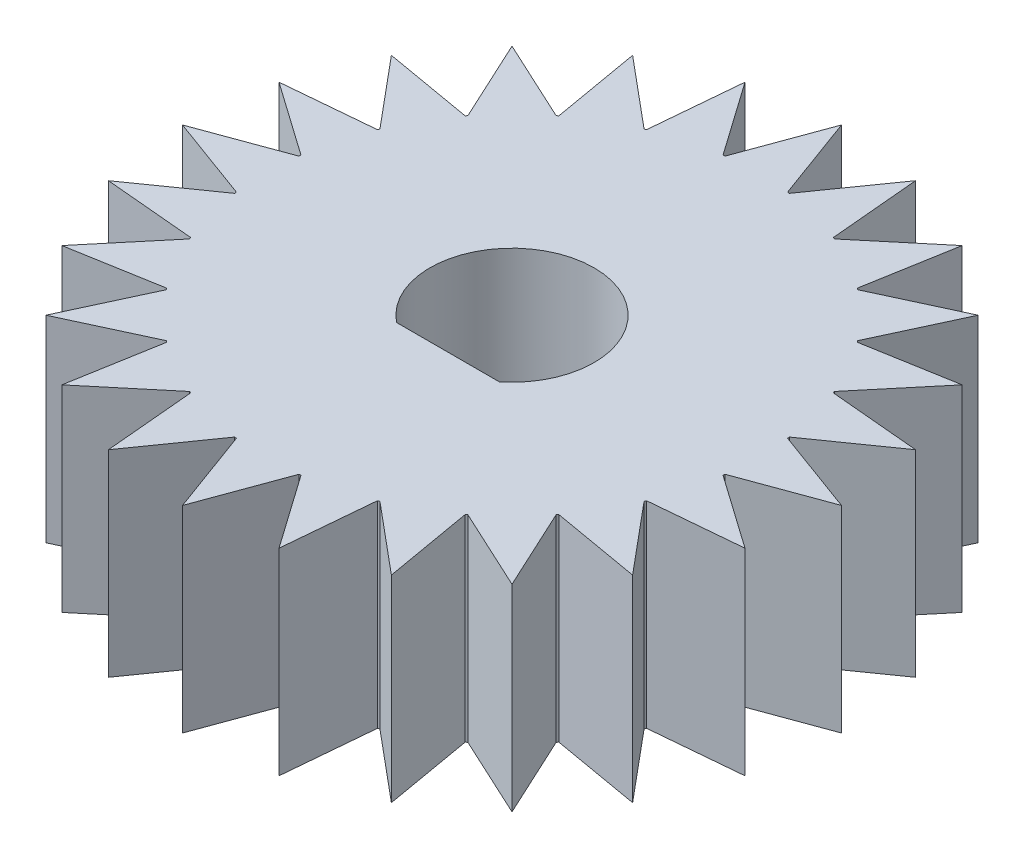
from build123d import *

# Parameters (mm, degrees)
SKETCH_1_R      = 7.5
EXTRUDE_2_DEPTH = 6


with BuildPart() as part:
    # Эскиз1 → Бобышка-Вытянуть2 (new body)
    # profile 1 of 25: a face of its own
    with BuildSketch(Plane(origin=(0, 0, 0), x_dir=(1, 0, 0), z_dir=(0, 1, 0))):
        Circle(SKETCH_1_R)
        with BuildLine():
            Line((-1.564448785, -1.95), (1.564448785, -1.95))
            ThreePointArc((1.564448785, -1.95), (0, 2.5), (-1.564448785, -1.95))
        make_face(mode=Mode.SUBTRACT)
    # profile 2 of 25: a face of its own
    with BuildSketch(Plane(origin=(0, 0, 0), x_dir=(1, 0, 0), z_dir=(0, 1, 0))):
        with BuildLine():
            Line((0, 10.03), (-0.949523561, 7.439650866))
            ThreePointArc((-0.949523561, 7.439650866), (0, 7.5), (0.949523561, 7.439650866))
            Line((0.949523561, 7.439650866), (0, 10.03))
        make_face()
    # profile 3 of 25: a face of its own
    with BuildSketch(Plane(origin=(0, 0, 0), x_dir=(1, 0, 0), z_dir=(0, 1, 0))):
        with BuildLine():
            ThreePointArc((-2.842692663, 6.940396129), (-1.941142838, 7.244443697), (-1.008354003, 7.431905691))
            Line((-1.008354003, 7.431905691), (-2.595955022, 9.688236038))
            Line((-2.595955022, 9.688236038), (-2.842692663, 6.940396129))
        make_face()
    # profile 4 of 25: a face of its own
    with BuildSketch(Plane(origin=(0, 0, 0), x_dir=(1, 0, 0), z_dir=(0, 1, 0))):
        with BuildLine():
            ThreePointArc((-4.542136958, 5.968164865), (-3.75, 6.495190528), (-2.897513908, 6.917688426))
            Line((-2.897513908, 6.917688426), (-5.015, 8.6862348))
            Line((-5.015, 8.6862348), (-4.542136958, 5.968164865))
        make_face()
    # profile 5 of 25: a face of its own
    with BuildSketch(Plane(origin=(0, 0, 0), x_dir=(1, 0, 0), z_dir=(0, 1, 0))):
        with BuildLine():
            ThreePointArc((-5.932042126, 4.589213028), (-5.303300859, 5.303300859), (-4.589213028, 5.932042126))
            Line((-4.589213028, 5.932042126), (-7.092281015, 7.092281015))
            Line((-7.092281015, 7.092281015), (-5.932042126, 4.589213028))
        make_face()
    # profile 6 of 25: a face of its own
    with BuildSketch(Plane(origin=(0, 0, 0), x_dir=(1, 0, 0), z_dir=(0, 1, 0))):
        with BuildLine():
            ThreePointArc((-6.917688426, 2.897513908), (-6.495190528, 3.75), (-5.968164865, 4.542136958))
            Line((-5.968164865, 4.542136958), (-8.6862348, 5.015))
            Line((-8.6862348, 5.015), (-6.917688426, 2.897513908))
        make_face()
    # profile 7 of 25: a face of its own
    with BuildSketch(Plane(origin=(0, 0, 0), x_dir=(1, 0, 0), z_dir=(0, 1, 0))):
        with BuildLine():
            ThreePointArc((-7.431905691, 1.008354003), (-7.244443697, 1.941142838), (-6.940396129, 2.842692663))
            Line((-6.940396129, 2.842692663), (-9.688236038, 2.595955022))
            Line((-9.688236038, 2.595955022), (-7.431905691, 1.008354003))
        make_face()
    # profile 8 of 25: a face of its own
    with BuildSketch(Plane(origin=(0, 0, 0), x_dir=(1, 0, 0), z_dir=(0, 1, 0))):
        with BuildLine():
            ThreePointArc((-7.439650866, -0.949523561), (-7.5, 0), (-7.439650866, 0.949523561))
            Line((-7.439650866, 0.949523561), (-10.03, 0))
            Line((-10.03, 0), (-7.439650866, -0.949523561))
        make_face()
    # profile 9 of 25: a face of its own
    with BuildSketch(Plane(origin=(0, 0, 0), x_dir=(1, 0, 0), z_dir=(0, 1, 0))):
        with BuildLine():
            ThreePointArc((-6.940396129, -2.842692663), (-7.244443697, -1.941142838), (-7.431905691, -1.008354003))
            Line((-7.431905691, -1.008354003), (-9.688236038, -2.595955022))
            Line((-9.688236038, -2.595955022), (-6.940396129, -2.842692663))
        make_face()
    # profile 10 of 25: a face of its own
    with BuildSketch(Plane(origin=(0, 0, 0), x_dir=(1, 0, 0), z_dir=(0, 1, 0))):
        with BuildLine():
            ThreePointArc((-5.968164865, -4.542136958), (-6.495190528, -3.75), (-6.917688426, -2.897513908))
            Line((-6.917688426, -2.897513908), (-8.6862348, -5.015))
            Line((-8.6862348, -5.015), (-5.968164865, -4.542136958))
        make_face()
    # profile 11 of 25: a face of its own
    with BuildSketch(Plane(origin=(0, 0, 0), x_dir=(1, 0, 0), z_dir=(0, 1, 0))):
        with BuildLine():
            ThreePointArc((-4.589213028, -5.932042126), (-5.303300859, -5.303300859), (-5.932042126, -4.589213028))
            Line((-5.932042126, -4.589213028), (-7.092281015, -7.092281015))
            Line((-7.092281015, -7.092281015), (-4.589213028, -5.932042126))
        make_face()
    # profile 12 of 25: a face of its own
    with BuildSketch(Plane(origin=(0, 0, 0), x_dir=(1, 0, 0), z_dir=(0, 1, 0))):
        with BuildLine():
            ThreePointArc((-2.897513908, -6.917688426), (-3.75, -6.495190528), (-4.542136958, -5.968164865))
            Line((-4.542136958, -5.968164865), (-5.015, -8.6862348))
            Line((-5.015, -8.6862348), (-2.897513908, -6.917688426))
        make_face()
    # profile 13 of 25: a face of its own
    with BuildSketch(Plane(origin=(0, 0, 0), x_dir=(1, 0, 0), z_dir=(0, 1, 0))):
        with BuildLine():
            ThreePointArc((-1.008354003, -7.431905691), (-1.941142838, -7.244443697), (-2.842692663, -6.940396129))
            Line((-2.842692663, -6.940396129), (-2.595955022, -9.688236038))
            Line((-2.595955022, -9.688236038), (-1.008354003, -7.431905691))
        make_face()
    # profile 14 of 25: a face of its own
    with BuildSketch(Plane(origin=(0, 0, 0), x_dir=(1, 0, 0), z_dir=(0, 1, 0))):
        with BuildLine():
            ThreePointArc((0.949523561, -7.439650866), (0, -7.5), (-0.949523561, -7.439650866))
            Line((-0.949523561, -7.439650866), (0, -10.03))
            Line((0, -10.03), (0.949523561, -7.439650866))
        make_face()
    # profile 15 of 25: a face of its own
    with BuildSketch(Plane(origin=(0, 0, 0), x_dir=(1, 0, 0), z_dir=(0, 1, 0))):
        with BuildLine():
            Line((2.595955022, -9.688236038), (2.842692663, -6.940396129))
            ThreePointArc((2.842692663, -6.940396129), (1.941142838, -7.244443697), (1.008354003, -7.431905691))
            Line((1.008354003, -7.431905691), (2.595955022, -9.688236038))
        make_face()
    # profile 16 of 25: a face of its own
    with BuildSketch(Plane(origin=(0, 0, 0), x_dir=(1, 0, 0), z_dir=(0, 1, 0))):
        with BuildLine():
            Line((5.015, -8.6862348), (4.542136958, -5.968164865))
            ThreePointArc((4.542136958, -5.968164865), (3.75, -6.495190528), (2.897513908, -6.917688426))
            Line((2.897513908, -6.917688426), (5.015, -8.6862348))
        make_face()
    # profile 17 of 25: a face of its own
    with BuildSketch(Plane(origin=(0, 0, 0), x_dir=(1, 0, 0), z_dir=(0, 1, 0))):
        with BuildLine():
            Line((7.092281015, -7.092281015), (5.932042126, -4.589213028))
            ThreePointArc((5.932042126, -4.589213028), (5.303300859, -5.303300859), (4.589213028, -5.932042126))
            Line((4.589213028, -5.932042126), (7.092281015, -7.092281015))
        make_face()
    # profile 18 of 25: a face of its own
    with BuildSketch(Plane(origin=(0, 0, 0), x_dir=(1, 0, 0), z_dir=(0, 1, 0))):
        with BuildLine():
            Line((8.6862348, -5.015), (6.917688426, -2.897513908))
            ThreePointArc((6.917688426, -2.897513908), (6.495190528, -3.75), (5.968164865, -4.542136958))
            Line((5.968164865, -4.542136958), (8.6862348, -5.015))
        make_face()
    # profile 19 of 25: a face of its own
    with BuildSketch(Plane(origin=(0, 0, 0), x_dir=(1, 0, 0), z_dir=(0, 1, 0))):
        with BuildLine():
            Line((9.688236038, -2.595955022), (7.431905691, -1.008354003))
            ThreePointArc((7.431905691, -1.008354003), (7.244443697, -1.941142838), (6.940396129, -2.842692663))
            Line((6.940396129, -2.842692663), (9.688236038, -2.595955022))
        make_face()
    # profile 20 of 25: a face of its own
    with BuildSketch(Plane(origin=(0, 0, 0), x_dir=(1, 0, 0), z_dir=(0, 1, 0))):
        with BuildLine():
            Line((10.03, 0), (7.439650866, 0.949523561))
            ThreePointArc((7.439650866, 0.949523561), (7.484897511, 0.475719721), (7.5, 0))
            ThreePointArc((7.5, 0), (7.484897511, -0.475719721), (7.439650866, -0.949523561))
            Line((7.439650866, -0.949523561), (10.03, 0))
        make_face()
    # profile 21 of 25: a face of its own
    with BuildSketch(Plane(origin=(0, 0, 0), x_dir=(1, 0, 0), z_dir=(0, 1, 0))):
        with BuildLine():
            Line((9.688236038, 2.595955022), (6.940396129, 2.842692663))
            ThreePointArc((6.940396129, 2.842692663), (7.244443697, 1.941142838), (7.431905691, 1.008354003))
            Line((7.431905691, 1.008354003), (9.688236038, 2.595955022))
        make_face()
    # profile 22 of 25: a face of its own
    with BuildSketch(Plane(origin=(0, 0, 0), x_dir=(1, 0, 0), z_dir=(0, 1, 0))):
        with BuildLine():
            Line((8.6862348, 5.015), (5.968164865, 4.542136958))
            ThreePointArc((5.968164865, 4.542136958), (6.495190528, 3.75), (6.917688426, 2.897513908))
            Line((6.917688426, 2.897513908), (8.6862348, 5.015))
        make_face()
    # profile 23 of 25: a face of its own
    with BuildSketch(Plane(origin=(0, 0, 0), x_dir=(1, 0, 0), z_dir=(0, 1, 0))):
        with BuildLine():
            Line((7.092281015, 7.092281015), (4.589213028, 5.932042126))
            ThreePointArc((4.589213028, 5.932042126), (5.303300859, 5.303300859), (5.932042126, 4.589213028))
            Line((5.932042126, 4.589213028), (7.092281015, 7.092281015))
        make_face()
    # profile 24 of 25: a face of its own
    with BuildSketch(Plane(origin=(0, 0, 0), x_dir=(1, 0, 0), z_dir=(0, 1, 0))):
        with BuildLine():
            Line((5.015, 8.6862348), (2.897513908, 6.917688426))
            ThreePointArc((2.897513908, 6.917688426), (3.75, 6.495190528), (4.542136958, 5.968164865))
            Line((4.542136958, 5.968164865), (5.015, 8.6862348))
        make_face()
    # profile 25 of 25: a face of its own
    with BuildSketch(Plane(origin=(0, 0, 0), x_dir=(1, 0, 0), z_dir=(0, 1, 0))):
        with BuildLine():
            Line((2.595955022, 9.688236038), (1.008354003, 7.431905691))
            ThreePointArc((1.008354003, 7.431905691), (1.941142838, 7.244443697), (2.842692663, 6.940396129))
            Line((2.842692663, 6.940396129), (2.595955022, 9.688236038))
        make_face()
    extrude(amount=EXTRUDE_2_DEPTH)


solid = part.part
